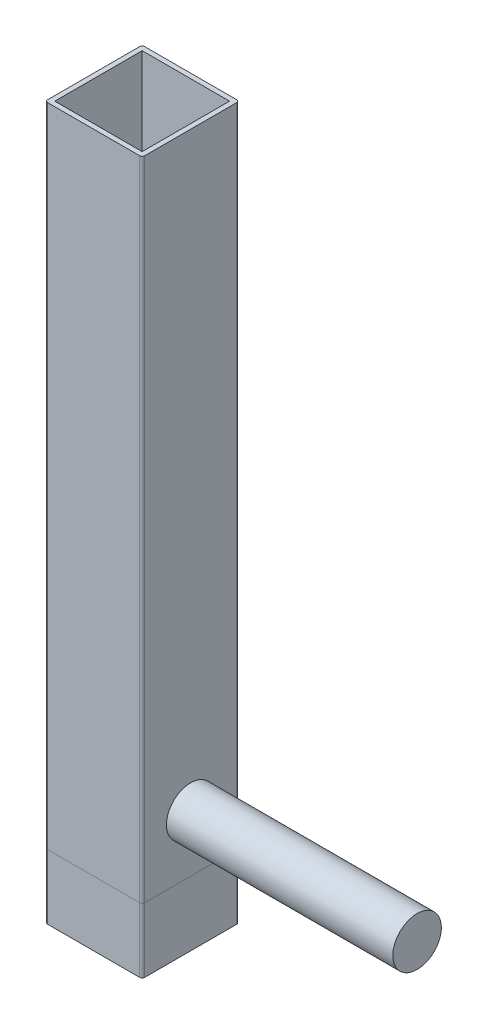
from build123d import *

# Parameters (mm, degrees)
CROQUIS11_W                         = 34.32
CROQUIS11_H                         = 34.32
PTR_PTR_1_5X1_5_CALIBRE14_1_DEPTH   = 254
CROQUIS11_ON_SEGMENT_2_W            = 34.32
CROQUIS11_ON_SEGMENT_2_H            = 34.32
PTR_PTR_1_5X1_5_CALIBRE14_1_2_DEPTH = 25.4
CROQUIS13_R                         = 9.525
SALIENTE_EXTRUIR1_DEPTH             = 88.9


with BuildPart() as part:
    # Croquis11 → Ptr PTR_1.5X1.5_CALIBRE14(1) (new body)
    with BuildSketch(Plane.XZ.offset(-254)):
        with BuildLine():
            Line((-18.05, -19.05), (18.05, -19.05))
            ThreePointArc((18.05, -19.05), (18.757106781, -18.757106781), (19.05, -18.05))
            Line((19.05, -18.05), (19.05, 18.05))
            ThreePointArc((19.05, 18.05), (18.757106781, 18.757106781), (18.05, 19.05))
            Line((18.05, 19.05), (-18.05, 19.05))
            ThreePointArc((-18.05, 19.05), (-18.757106781, 18.757106781), (-19.05, 18.05))
            Line((-19.05, 18.05), (-19.05, -18.05))
            ThreePointArc((-19.05, -18.05), (-18.757106781, -18.757106781), (-18.05, -19.05))
        make_face()
        Rectangle(CROQUIS11_W, CROQUIS11_H, mode=Mode.SUBTRACT)
    extrude(amount=PTR_PTR_1_5X1_5_CALIBRE14_1_DEPTH)


with BuildPart() as body_2:
    # Croquis11 on segment 2 (carried to segment 2) → Ptr PTR_1.5X1.5_CALIBRE14_1 2 (new body)
    with BuildSketch(Plane.XZ):
        with BuildLine():
            Line((-18.05, -19.05), (18.05, -19.05))
            ThreePointArc((18.05, -19.05), (18.757106781, -18.757106781), (19.05, -18.05))
            Line((19.05, -18.05), (19.05, 18.05))
            ThreePointArc((19.05, 18.05), (18.757106781, 18.757106781), (18.05, 19.05))
            Line((18.05, 19.05), (-18.05, 19.05))
            ThreePointArc((-18.05, 19.05), (-18.757106781, 18.757106781), (-19.05, 18.05))
            Line((-19.05, 18.05), (-19.05, -18.05))
            ThreePointArc((-19.05, -18.05), (-18.757106781, -18.757106781), (-18.05, -19.05))
        make_face()
        Rectangle(CROQUIS11_ON_SEGMENT_2_W, CROQUIS11_ON_SEGMENT_2_H, mode=Mode.SUBTRACT)
    extrude(amount=PTR_PTR_1_5X1_5_CALIBRE14_1_2_DEPTH)


with BuildPart() as body_3:
    # Croquis13 → Saliente-Extruir1 (new body)
    with BuildSketch(Plane(origin=(19.05, 0, 0), x_dir=(0, 0, -1), z_dir=(1, 0, 0))):
        with Locations((0, 22.225)):
            Circle(CROQUIS13_R)
    extrude(amount=SALIENTE_EXTRUIR1_DEPTH)


solid = Compound([part.part, body_2.part, body_3.part])
